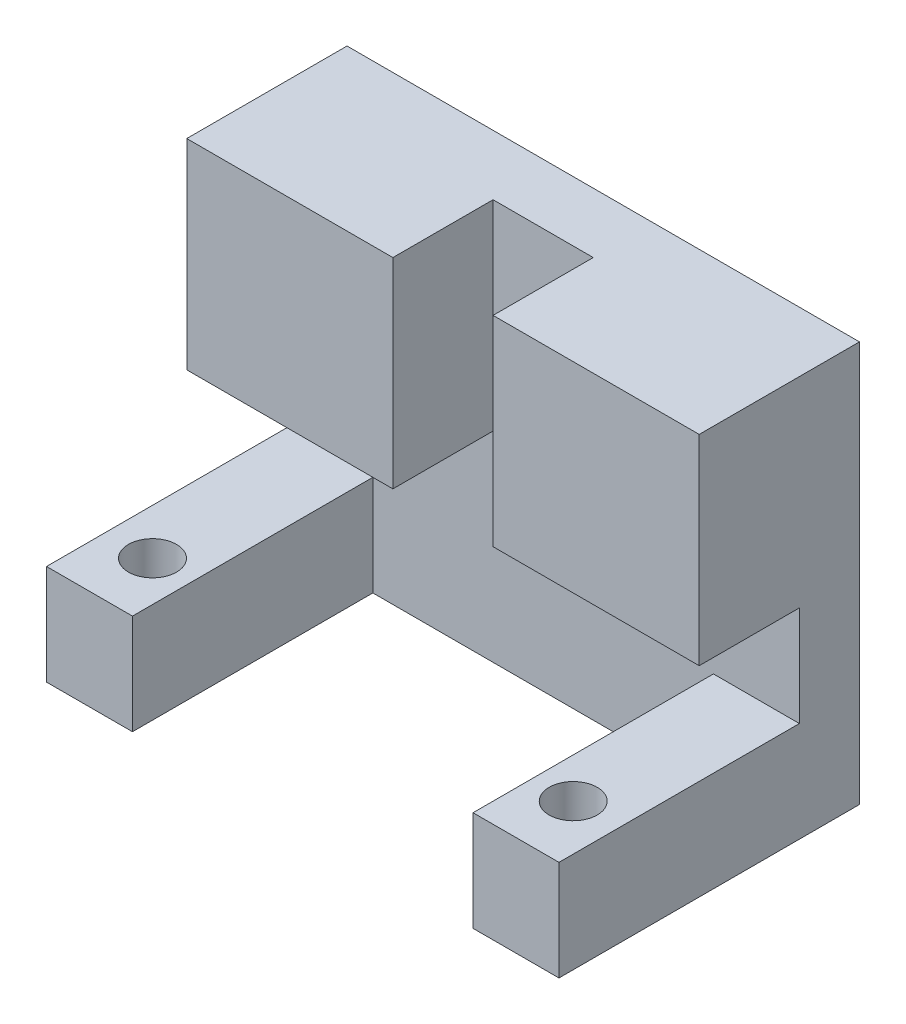
from build123d import *

# Parameters (mm, degrees)
SKETCH_1_W          = 25.58
SKETCH_1_H          = 20
EXTRUDE_1_DEPTH     = 15
SKETCH_4_W          = 25.58
SKETCH_4_H          = 15
CUT_EXTRUDE_3_DEPTH = 7
SKETCH_5_W          = 5
SKETCH_5_H          = 5
CUT_EXTRUDE_4_DEPTH = 32.294350928
CUT_EXTRUDE_5_REACH = 30.082
SKETCH_6_W          = 5
SKETCH_6_H          = 5
HOLE_WIZARD_M2_1_D  = 2.4
SKETCH_10_W         = 17
SKETCH_10_H         = 12
CUT_EXTRUDE_7_DEPTH = 25.770629786


with BuildPart() as part:
    # ｽｹｯﾁ1 → ﾎﾞｽ - 押し出し1 (new body)
    with BuildSketch(Plane.XY):
        Rectangle(SKETCH_1_W, SKETCH_1_H)
    extrude(amount=EXTRUDE_1_DEPTH)

    # ｽｹｯﾁ4 → ｶｯﾄ - 押し出し3 (cut)
    with BuildSketch(Plane.XY.offset(15)):
        with Locations((0, 2.5)):
            Rectangle(SKETCH_4_W, SKETCH_4_H)
    extrude(amount=-CUT_EXTRUDE_3_DEPTH, mode=Mode.SUBTRACT)

    # ｽｹｯﾁ5 → ｶｯﾄ - 押し出し4 (cut, through all)
    with BuildSketch(Plane(origin=(12.79, 0, 0), x_dir=(0, 0, -1), z_dir=(1, 0, 0))):
        with Locations((-5.5, -2.5)):
            Rectangle(SKETCH_5_W, SKETCH_5_H)
    extrude(amount=-CUT_EXTRUDE_4_DEPTH, mode=Mode.SUBTRACT)

    # ｽｹｯﾁ6 → ｶｯﾄ - 押し出し5 (cut, up to next)
    with BuildSketch(Plane(origin=(0, 10, 0), x_dir=(1, 0, 0), z_dir=(0, 1, 0)), mode=Mode.PRIVATE) as cut_extrude_5_sk1:
        with Locations((0, -5.5)):
            Rectangle(SKETCH_6_W, SKETCH_6_H)
    cut_extrude_5_tool1 = extrude(cut_extrude_5_sk1.sketch, amount=-CUT_EXTRUDE_5_REACH, mode=Mode.PRIVATE) & part.part
    add(cut_extrude_5_tool1.solids().sort_by_distance((0, 10, 5.5))[0], mode=Mode.SUBTRACT)

    # M2 すきま穴1 (through all)
    with Locations(Plane(origin=(0, -5, 0), x_dir=(1, 0, 0), z_dir=(0, 1, 0))):
        with Locations((10.5, -12), (-10.5, -12)):
            Hole(HOLE_WIZARD_M2_1_D / 2)

    # ｽｹｯﾁ10 → ｶｯﾄ - 押し出し7 (cut, through all)
    with BuildSketch(Plane(origin=(0, -5, 0), x_dir=(1, 0, 0), z_dir=(0, 1, 0))):
        with Locations((0, -9)):
            Rectangle(SKETCH_10_W, SKETCH_10_H)
    extrude(amount=-CUT_EXTRUDE_7_DEPTH, mode=Mode.SUBTRACT)


solid = part.part
